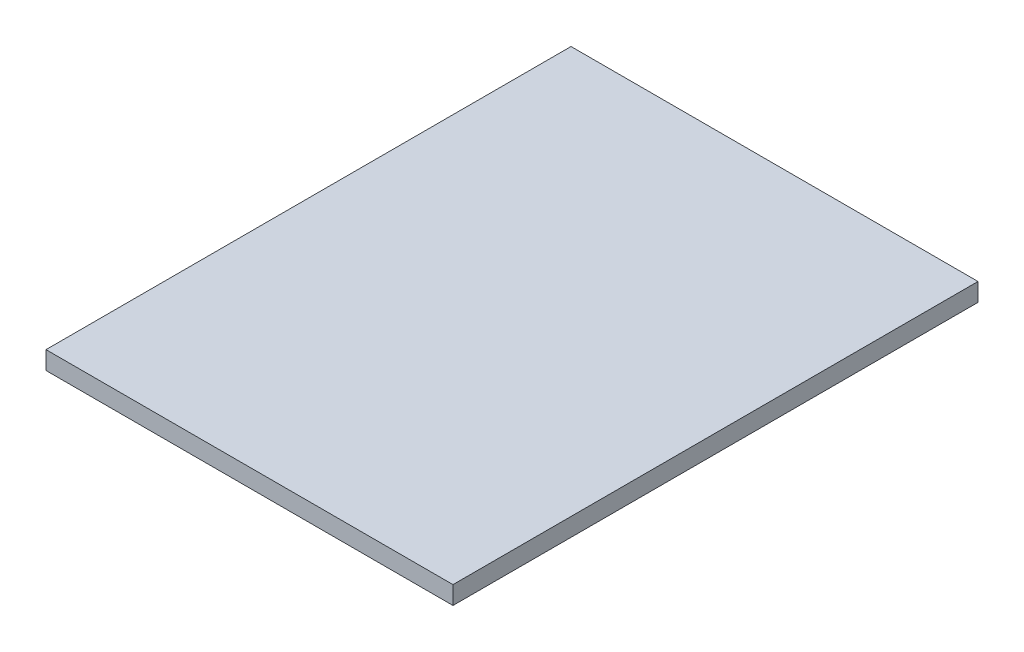
from build123d import *

# Parameters (mm, degrees)
ESQUISSE1_W        = 22.48
ESQUISSE1_H        = 29
BOSS_EXTRU_2_DEPTH = 1


with BuildPart() as part:
    # Esquisse1 → Boss.-Extru.2 (new body)
    with BuildSketch(Plane(origin=(0, 0, 0), x_dir=(1, 0, 0), z_dir=(0, 1, 0))):
        with Locations((11.24, 14.5)):
            Rectangle(ESQUISSE1_W, ESQUISSE1_H)
    extrude(amount=BOSS_EXTRU_2_DEPTH)


solid = part.part
